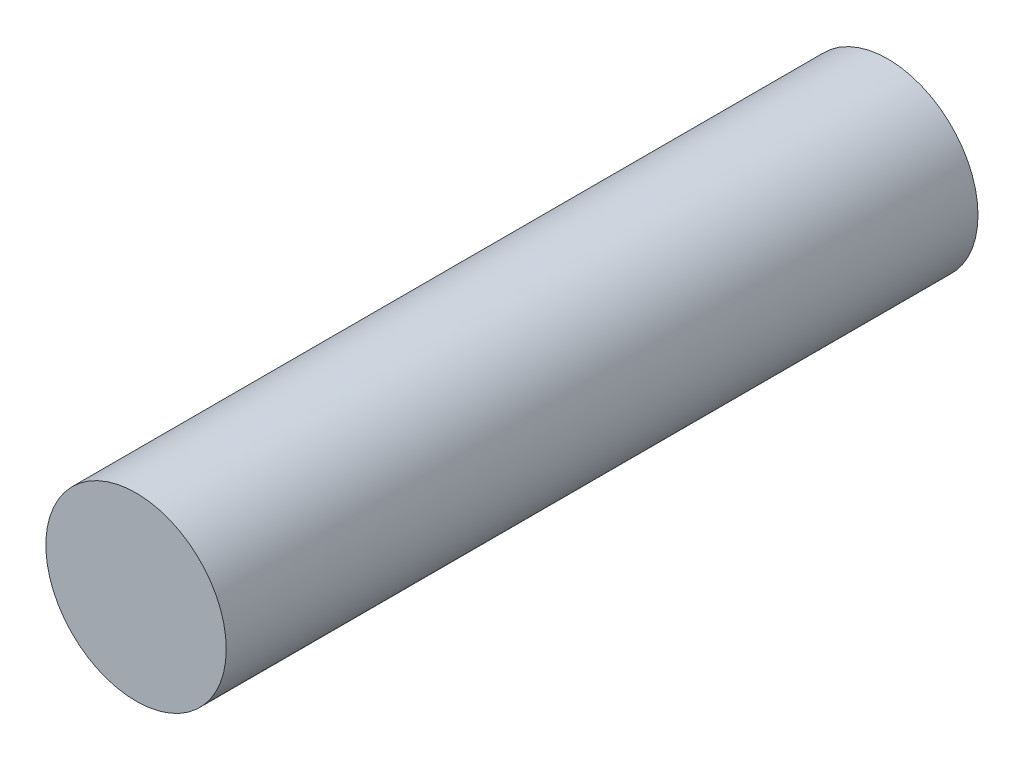
from build123d import *

# Parameters (mm, degrees)
SKETCH2_R           = 6
BOSS_EXTRUDE1_DEPTH = 25


with BuildPart() as part:
    # Sketch2 → Boss-Extrude1 (new, symmetric)
    with BuildSketch(Plane.XY):
        Circle(SKETCH2_R)
    extrude(amount=BOSS_EXTRUDE1_DEPTH, both=True)


solid = part.part
